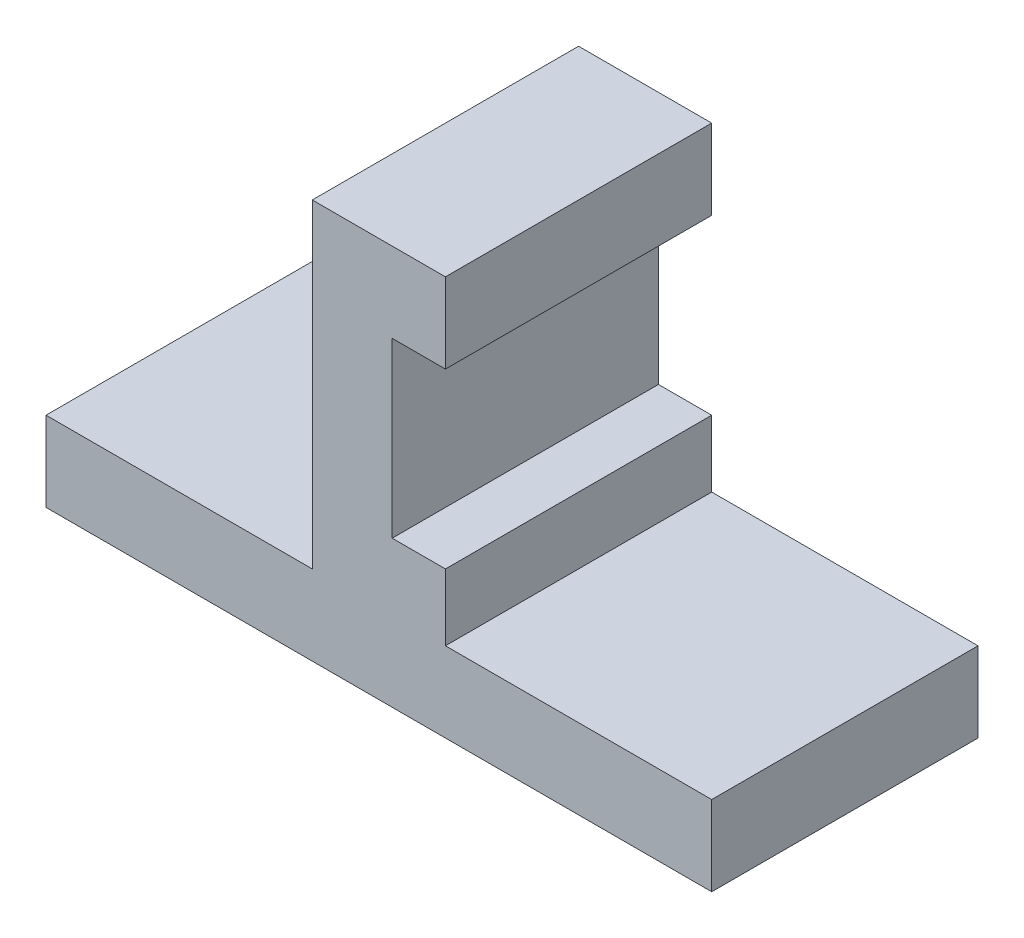
from build123d import *

# Parameters (mm, degrees)
SKETCH1_W           = 25
SKETCH1_H           = 10
BOSS_EXTRUDE2_DEPTH = 3
SKETCH2_W           = 5
SKETCH2_H           = 10
BOSS_EXTRUDE4_DEPTH = 12
SKETCH4_W           = 10
SKETCH4_H           = 6.5
CUT_EXTRUDE1_DEPTH  = 2


with BuildPart() as part:
    # Sketch1 → Boss-Extrude2 (new body)
    with BuildSketch(Plane(origin=(0, 0, 0), x_dir=(1, 0, 0), z_dir=(0, 1, 0))):
        Rectangle(SKETCH1_W, SKETCH1_H)
    extrude(amount=BOSS_EXTRUDE2_DEPTH)

    # Sketch2 → Boss-Extrude4 (add)
    with BuildSketch(Plane(origin=(0, 3, 0), x_dir=(1, 0, 0), z_dir=(0, 1, 0))):
        Rectangle(SKETCH2_W, SKETCH2_H)
    extrude(amount=BOSS_EXTRUDE4_DEPTH)

    # Sketch4 → Cut-Extrude1 (cut)
    with BuildSketch(Plane(origin=(2.5, 0, 0), x_dir=(0, 0, -1), z_dir=(1, 0, 0))):
        with Locations((0, 8.75)):
            Rectangle(SKETCH4_W, SKETCH4_H)
    extrude(amount=-CUT_EXTRUDE1_DEPTH, mode=Mode.SUBTRACT)


solid = part.part
